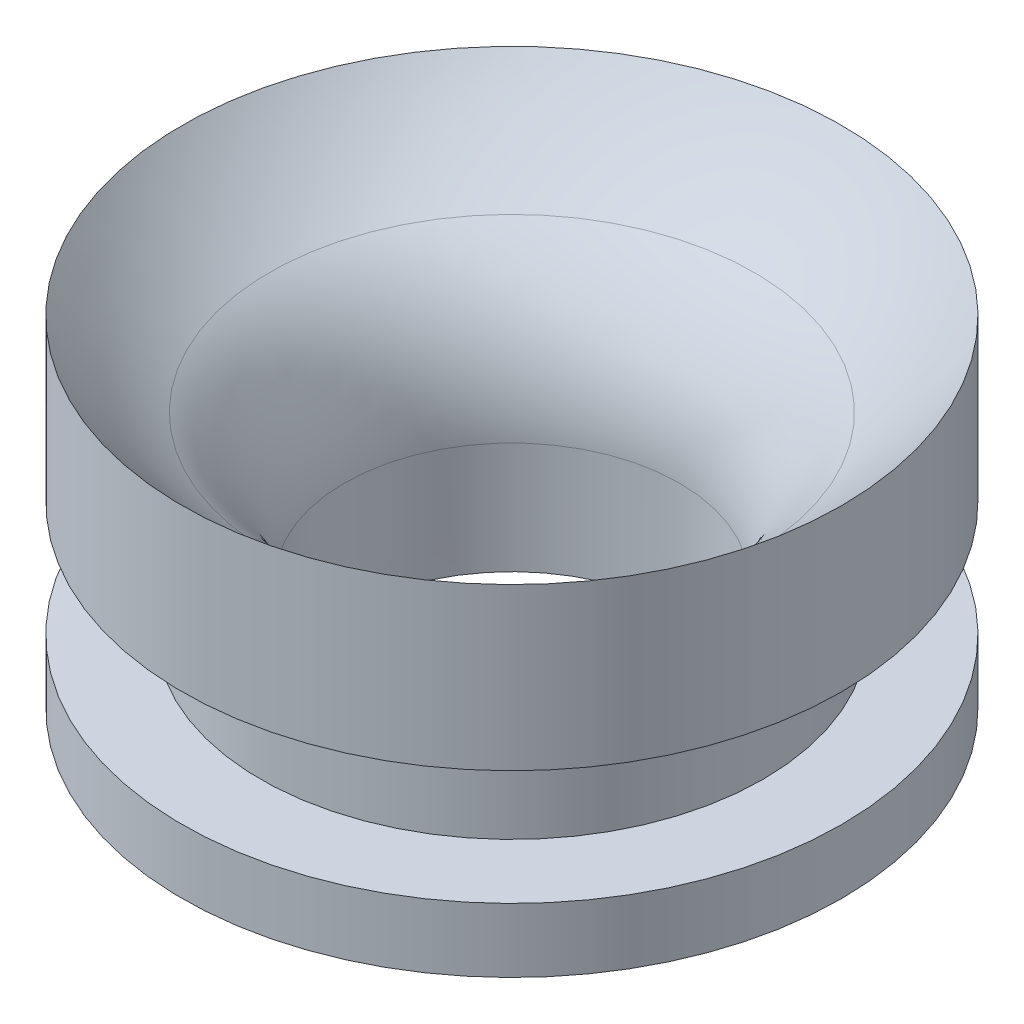
from build123d import *

# Parameters (mm, degrees)
SKETCH4_R          = 4.7752
CUT_EXTRUDE1_DEPTH = 12.446
FILLET2_R          = 5.08


with BuildPart() as part:
    # Sketch3 → Revolve3 (revolve)
    with BuildSketch(Plane.XY):
        Polygon((7.1628, 1.8288), (7.1628, 5.1054), (0, 5.1054), (0, 0), (9.398, 0), (9.398, 1.8288), align=None)
        with BuildLine():
            ThreePointArc((0, 5.1054), (5.231120596, 6.316339666), (9.398, 9.7028))
            Line((9.398, 9.7028), (9.398, 5.1054))
            Line((9.398, 5.1054), (7.1628, 5.1054))
            Line((7.1628, 5.1054), (0, 5.1054))
        make_face()
    revolve(axis=Axis((0, 0, 0), (0, 1, 0)))

    # Sketch4 → Cut-Extrude1 (cut)
    with BuildSketch(Plane.XZ):
        Circle(SKETCH4_R)
    extrude(amount=-CUT_EXTRUDE1_DEPTH, mode=Mode.SUBTRACT)

    # Fillet2
    fillet2_edges = [part.edges().sort_by_distance(p)[0] for p in [
        (-4.7752, 6.105113597, 2e-09),
    ]]
    fillet(fillet2_edges, radius=FILLET2_R)


solid = part.part
